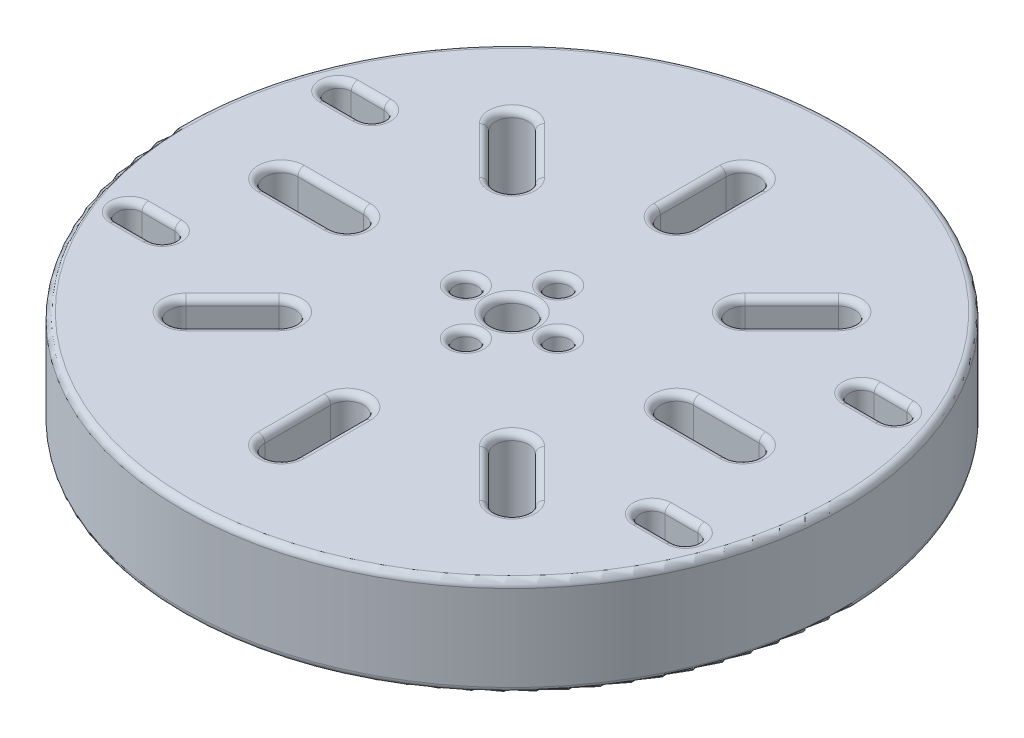
from build123d import *

# Parameters (mm, degrees)
SKETCH1_R           = 50
BOSS_EXTRUDE1_DEPTH = 15
CUT_EXTRUDE1_DEPTH  = 73.284161474
SKETCH6_R           = 12.5
CUT_EXTRUDE2_DEPTH  = 5
SKETCH7_R           = 1.75
SKETCH7_R_2         = 3
CUT_EXTRUDE3_DEPTH  = 72.414284285
FILLET19_R          = 1


with BuildPart() as part:
    # Sketch1 → Boss-Extrude1 (new body)
    with BuildSketch(Plane(origin=(0, 0, 0), x_dir=(1, 0, 0), z_dir=(0, 1, 0))):
        with Locations(Location((0, 0, 0), (0, 0, 270))):
            Circle(SKETCH1_R)
    extrude(amount=BOSS_EXTRUDE1_DEPTH)

    # Sketch5 → Cut-Extrude1 (cut, through all)
    with BuildSketch(Plane.XZ):
        with BuildLine():
            Line((25, 2.5), (35, 2.5))
            ThreePointArc((35, 2.5), (37.5, 0), (35, -2.5))
            Line((35, -2.5), (25, -2.5))
            ThreePointArc((25, -2.5), (22.5, 0), (25, 2.5))
        make_face()
        with BuildLine():
            Line((19.445436483, -15.909902577), (26.516504294, -22.980970389))
            ThreePointArc((26.516504294, -22.980970389), (26.516504294, -26.516504294), (22.980970389, -26.516504294))
            Line((22.980970389, -26.516504294), (15.909902577, -19.445436483))
            ThreePointArc((15.909902577, -19.445436483), (15.909902577, -15.909902577), (19.445436483, -15.909902577))
        make_face()
        with BuildLine():
            Line((2.5, -25), (2.5, -35))
            ThreePointArc((2.5, -35), (0, -37.5), (-2.5, -35))
            Line((-2.5, -35), (-2.5, -25))
            ThreePointArc((-2.5, -25), (0, -22.5), (2.5, -25))
        make_face()
        with BuildLine():
            Line((-15.909902577, -19.445436483), (-22.980970389, -26.516504294))
            ThreePointArc((-22.980970389, -26.516504294), (-26.516504294, -26.516504294), (-26.516504294, -22.980970389))
            Line((-26.516504294, -22.980970389), (-19.445436483, -15.909902577))
            ThreePointArc((-19.445436483, -15.909902577), (-15.909902577, -15.909902577), (-15.909902577, -19.445436483))
        make_face()
        with BuildLine():
            Line((37.17, -13.98), (42.17, -13.98))
            ThreePointArc((42.17, -13.98), (44.07, -15.88), (42.17, -17.78))
            Line((42.17, -17.78), (37.17, -17.78))
            ThreePointArc((37.17, -17.78), (35.27, -15.88), (37.17, -13.98))
        make_face()
        with BuildLine():
            Line((37.17, 17.78), (42.17, 17.78))
            ThreePointArc((42.17, 17.78), (44.07, 15.88), (42.17, 13.98))
            Line((42.17, 13.98), (37.17, 13.98))
            ThreePointArc((37.17, 13.98), (35.27, 15.88), (37.17, 17.78))
        make_face()
        with BuildLine():
            Line((-42.17, -13.98), (-37.17, -13.98))
            ThreePointArc((-37.17, -13.98), (-35.27, -15.88), (-37.17, -17.78))
            Line((-37.17, -17.78), (-42.17, -17.78))
            ThreePointArc((-42.17, -17.78), (-44.07, -15.88), (-42.17, -13.98))
        make_face()
        with BuildLine():
            Line((-42.17, 17.78), (-37.17, 17.78))
            ThreePointArc((-37.17, 17.78), (-35.27, 15.88), (-37.17, 13.98))
            Line((-37.17, 13.98), (-42.17, 13.98))
            ThreePointArc((-42.17, 13.98), (-44.07, 15.88), (-42.17, 17.78))
        make_face()
        with BuildLine():
            Line((-25, -2.5), (-35, -2.5))
            ThreePointArc((-35, -2.5), (-37.5, 0), (-35, 2.5))
            Line((-35, 2.5), (-25, 2.5))
            ThreePointArc((-25, 2.5), (-22.5, 0), (-25, -2.5))
        make_face()
        with BuildLine():
            Line((-19.445436483, 15.909902577), (-26.516504294, 22.980970389))
            ThreePointArc((-26.516504294, 22.980970389), (-26.516504294, 26.516504294), (-22.980970389, 26.516504294))
            Line((-22.980970389, 26.516504294), (-15.909902577, 19.445436483))
            ThreePointArc((-15.909902577, 19.445436483), (-15.909902577, 15.909902577), (-19.445436483, 15.909902577))
        make_face()
        with BuildLine():
            Line((-2.5, 25), (-2.5, 35))
            ThreePointArc((-2.5, 35), (0, 37.5), (2.5, 35))
            Line((2.5, 35), (2.5, 25))
            ThreePointArc((2.5, 25), (0, 22.5), (-2.5, 25))
        make_face()
        with BuildLine():
            Line((15.909902577, 19.445436483), (22.980970389, 26.516504294))
            ThreePointArc((22.980970389, 26.516504294), (26.516504294, 26.516504294), (26.516504294, 22.980970389))
            Line((26.516504294, 22.980970389), (19.445436483, 15.909902577))
            ThreePointArc((19.445436483, 15.909902577), (15.909902577, 15.909902577), (15.909902577, 19.445436483))
        make_face()
    extrude(amount=-CUT_EXTRUDE1_DEPTH, mode=Mode.SUBTRACT)

    # Sketch6 → Cut-Extrude2 (cut)
    with BuildSketch(Plane.XZ):
        with Locations(Location((0, 0, 0), (0, 0, 270))):
            Circle(SKETCH6_R)
    extrude(amount=-CUT_EXTRUDE2_DEPTH, mode=Mode.SUBTRACT)

    # Sketch7 → Cut-Extrude3 (cut, through all)
    with BuildSketch(Plane.XZ.offset(-5)):
        with Locations(Location((7, 0, 0), (0, 0, 270))):
            Circle(SKETCH7_R)
        with Locations(Location((0, -7, 0), (0, 0, 270))):
            Circle(SKETCH7_R)
        with Locations(Location((-7, 0, 0), (0, 0, 270))):
            Circle(SKETCH7_R)
        with Locations(Location((0, 7, 0), (0, 0, 270))):
            Circle(SKETCH7_R)
        with Locations(Location((0, 0, 0), (0, 0, 270))):
            Circle(SKETCH7_R_2)
    extrude(amount=-CUT_EXTRUDE3_DEPTH, mode=Mode.SUBTRACT)

    # Fillet19
    fillet19_edges = [part.edges().sort_by_distance(p)[0] for p in [
        (-44.07, 15, 15.88),
        (-39.67, 15, 17.78),
        (-35.27, 15, 15.88),
        (-39.67, 15, 13.98),
        (37.5, 15, 0),
        (-44.07, 0, 15.88),
        (-39.67, 0, 13.98),
        (-35.27, 0, 15.88),
        (-39.67, 0, 17.78),
        (30, 15, -2.5),
        (22.5, 0, 0),
        (30, 0, -2.5),
        (-22.5, 15, 0),
        (-30, 15, -2.5),
        (-37.5, 15, 0),
        (-30, 15, 2.5),
        (-22.5, 0, 0),
        (-30, 0, 2.5),
        (-37.5, 0, 0),
        (-30, 0, -2.5),
        (37.5, 0, 0),
        (30, 0, 2.5),
        (-15.909902577, 15, 15.909902577),
        (-22.980970389, 15, 19.445436483),
        (-26.516504294, 15, 26.516504294),
        (-19.445436483, 15, 22.980970389),
        (-15.909902577, 0, 15.909902577),
        (-19.445436483, 0, 22.980970389),
        (-26.516504294, 0, 26.516504294),
        (-22.980970389, 0, 19.445436483),
        (0, 15, 22.5),
        (-2.5, 15, 30),
        (0, 15, 37.5),
        (2.5, 15, 30),
        (0, 0, 22.5),
        (2.5, 0, 30),
        (0, 0, 37.5),
        (-2.5, 0, 30),
        (15.909902577, 15, 15.909902577),
        (19.445436483, 15, 22.980970389),
        (26.516504294, 15, 26.516504294),
        (22.980970389, 15, 19.445436483),
        (15.909902577, 0, 15.909902577),
        (22.980970389, 0, 19.445436483),
        (26.516504294, 0, 26.516504294),
        (19.445436483, 0, 22.980970389),
        (0, 0, -50),
        (0, 0, 12.5),
        (7, 15, 1.75),
        (0, 15, 3),
        (0, 15, -5.25),
        (-7, 15, 1.75),
        (0, 15, 8.75),
        (15.909902577, 15, -15.909902577),
        (22.980970389, 15, -19.445436483),
        (26.516504294, 15, -26.516504294),
        (19.445436483, 15, -22.980970389),
        (15.909902577, 0, -15.909902577),
        (19.445436483, 0, -22.980970389),
        (26.516504294, 0, -26.516504294),
        (22.980970389, 0, -19.445436483),
        (0, 15, -22.5),
        (2.5, 15, -30),
        (0, 15, -37.5),
        (-2.5, 15, -30),
        (0, 0, -22.5),
        (-2.5, 0, -30),
        (0, 0, -37.5),
        (2.5, 0, -30),
        (0, 15, -50),
        (-15.909902577, 15, -15.909902577),
        (-19.445436483, 15, -22.980970389),
        (-26.516504294, 15, -26.516504294),
        (-22.980970389, 15, -19.445436483),
        (-15.909902577, 0, -15.909902577),
        (-22.980970389, 0, -19.445436483),
        (-26.516504294, 0, -26.516504294),
        (-19.445436483, 0, -22.980970389),
        (35.27, 15, -15.88),
        (39.67, 15, -13.98),
        (44.07, 15, -15.88),
        (39.67, 15, -17.78),
        (35.27, 0, -15.88),
        (39.67, 0, -17.78),
        (44.07, 0, -15.88),
        (39.67, 0, -13.98),
        (35.27, 15, 15.88),
        (39.67, 15, 17.78),
        (44.07, 15, 15.88),
        (39.67, 15, 13.98),
        (35.27, 0, 15.88),
        (39.67, 0, 13.98),
        (44.07, 0, 15.88),
        (39.67, 0, 17.78),
        (-44.07, 15, -15.88),
        (-39.67, 15, -13.98),
        (-35.27, 15, -15.88),
        (-39.67, 15, -17.78),
        (-44.07, 0, -15.88),
        (-39.67, 0, -17.78),
        (-35.27, 0, -15.88),
        (-39.67, 0, -13.98),
        (22.5, 15, 0),
        (30, 15, 2.5),
    ]]
    fillet(fillet19_edges, radius=FILLET19_R)


solid = part.part
